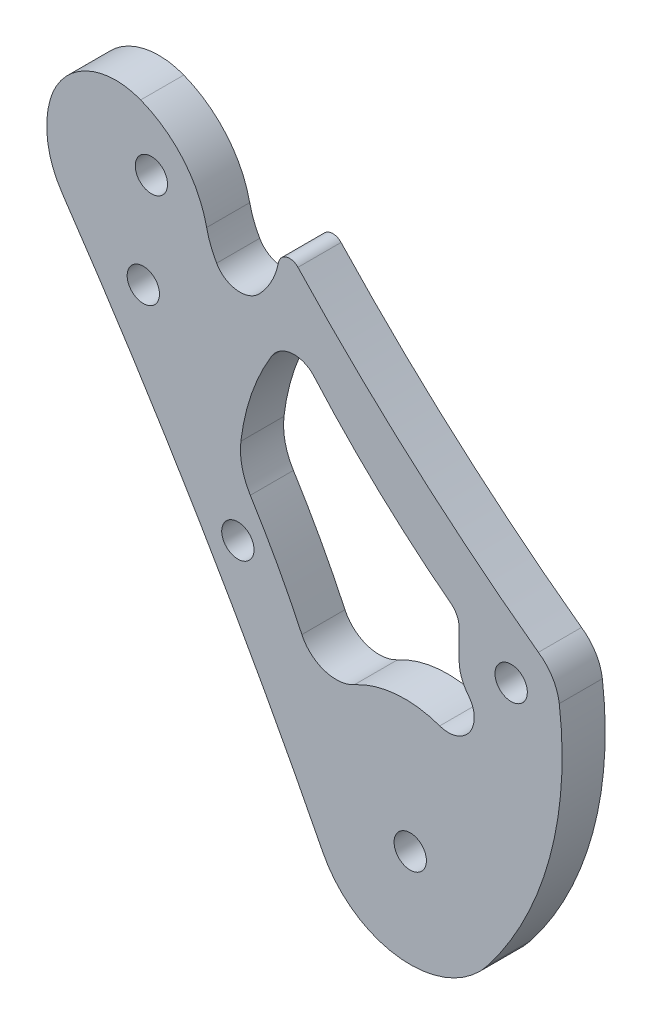
from build123d import *

# Parameters (mm, degrees)
ESQUISSE1_R             = 1.5
ESQUISSE1_R_2           = 1.50110642
BOSS_EXTRU_1_DEPTH      = 4
ENL_V_MAT_EXTRU_1_REACH = 124.989
ESQUISSE2_R             = 1.5


with BuildPart() as part:
    # Esquisse1 → Boss.-Extru.1 (new body)
    with BuildSketch(Plane.XY):
        with BuildLine():
            ThreePointArc((60.026944648, 49.921558504), (72.778337749, 29.898863696), (84.195273994, 9.086369847))
            ThreePointArc((84.195273994, 9.086369847), (91.451273571, 4.140927091), (99.509067829, 7.630753106))
            ThreePointArc((99.509067829, 7.630753106), (105.251720368, 19.156706799), (106.145904128, 32.002955361))
            ThreePointArc((106.145904128, 32.002955361), (105.517176975, 33.787686969), (104.210334733, 35.15616353))
            ThreePointArc((104.210334733, 35.15616353), (92.58899703, 44.531440422), (81.889188019, 54.946112475))
            ThreePointArc((81.889188019, 54.946112475), (80.829609942, 55.239205413), (80.085451585, 54.429985101))
            ThreePointArc((80.085451585, 54.429985101), (79.43974416, 52.594599516), (78.30149473, 51.016636729))
            ThreePointArc((78.30149473, 51.016636729), (76.19777745, 50.272546762), (74.337717048, 51.505215238))
            ThreePointArc((74.337717048, 51.505215238), (73.781586954, 52.671085372), (73.412965229, 53.909088553))
            ThreePointArc((73.412965229, 53.909088553), (71.258227235, 58.277263879), (67.291581582, 61.103847288))
            ThreePointArc((67.291581582, 61.103847288), (62.173852637, 60.880940246), (58.891944342, 56.947758957))
            ThreePointArc((58.891944342, 56.947758957), (58.674610839, 53.307878055), (60.026944648, 49.921558504))
        make_face()
        with Locations((68.285467108, 55.560427953)):
            Circle(ESQUISSE1_R, mode=Mode.SUBTRACT)
        with Locations((101.682075096, 31.433543054)):
            Circle(ESQUISSE1_R, mode=Mode.SUBTRACT)
        with Locations((92.312371453, 13.200094295)):
            Circle(ESQUISSE1_R, mode=Mode.SUBTRACT)
        with Locations((67.535467108, 46.360427953)):
            Circle(ESQUISSE1_R_2, mode=Mode.SUBTRACT)
        with BuildLine():
            Line((96.849719723, 30.848999233), (96.849719723, 33.474650871))
            ThreePointArc((96.849719723, 33.474650871), (96.647309876, 34.343108764), (96.081794601, 35.032587793))
            ThreePointArc((96.081794601, 35.032587793), (89.436975045, 40.671042336), (83.372922141, 46.929880801))
            ThreePointArc((83.372922141, 46.929880801), (81.323140328, 47.752609653), (79.445810973, 46.588941858))
            ThreePointArc((79.445810973, 46.588941858), (77.571604785, 42.607109512), (76.591708968, 38.316720036))
            ThreePointArc((76.591708968, 38.316720036), (76.69683067, 36.288635677), (77.467153905, 34.409598995))
            ThreePointArc((77.467153905, 34.409598995), (79.992055499, 30.078906011), (82.254048976, 25.605270433))
            ThreePointArc((82.254048976, 25.605270433), (84.350090923, 23.753861276), (87.134236378, 24.017758597))
            ThreePointArc((87.134236378, 24.017758597), (91.023623533, 25.188476532), (95.051173024, 24.662398573))
            ThreePointArc((95.051173024, 24.662398573), (97.816197879, 25.543673578), (97.709238653, 28.443771474))
            ThreePointArc((97.709238653, 28.443771474), (97.07105369, 29.571903567), (96.849719723, 30.848999233))
        make_face(mode=Mode.SUBTRACT)
    extrude(amount=BOSS_EXTRU_1_DEPTH)

    # Esquisse2 → Enlèv. mat.-Extru.1 (cut, up to next)
    with BuildSketch(Plane.XY.offset(4), mode=Mode.PRIVATE) as enl_v_mat_extru_1_sk1:
        with Locations((76.312371453, 30.200094295)):
            Circle(ESQUISSE2_R)
    enl_v_mat_extru_1_tool1 = extrude(enl_v_mat_extru_1_sk1.sketch, amount=-ENL_V_MAT_EXTRU_1_REACH, mode=Mode.PRIVATE) & part.part
    add(enl_v_mat_extru_1_tool1.solids().sort_by_distance((76.312371, 30.200094, 4))[0], mode=Mode.SUBTRACT)


solid = part.part
